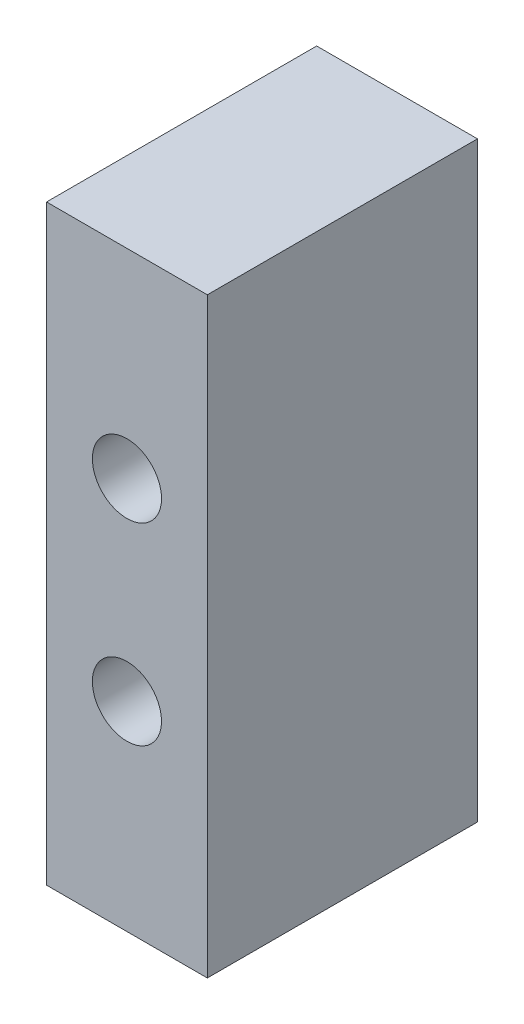
from build123d import *

# Parameters (mm, degrees)
SKETCH_1_W      = 10
SKETCH_1_H      = 36.8
SKETCH_1_R      = 2.15
EXTRUDE_1_DEPTH = 16.8


with BuildPart() as part:
    # 草图1 → 凸台-拉伸1 (new body)
    with BuildSketch(Plane.XY):
        Rectangle(SKETCH_1_W, SKETCH_1_H)
        with Locations((0, 6)):
            Circle(SKETCH_1_R, mode=Mode.SUBTRACT)
        with Locations(Location((0, -6, 0), (0, 0, 180))):
            Circle(SKETCH_1_R, mode=Mode.SUBTRACT)
    extrude(amount=EXTRUDE_1_DEPTH)


solid = part.part
